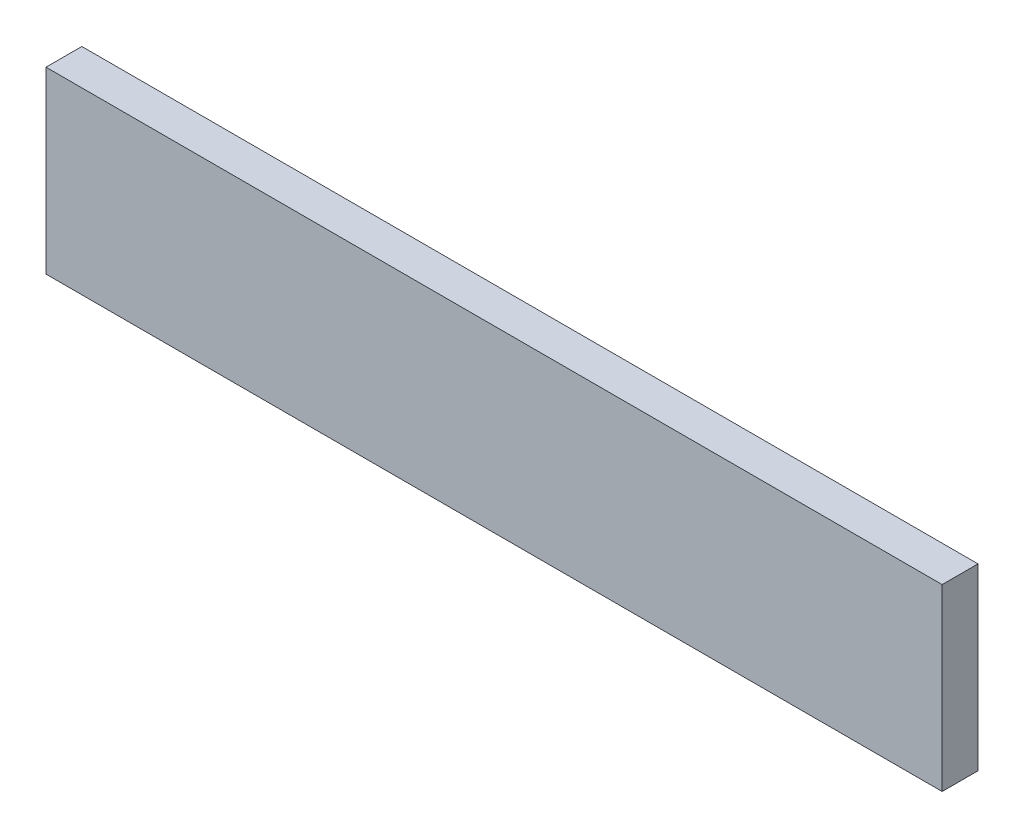
from build123d import *

# Parameters (mm, degrees)
SKETCH1_W           = 50
SKETCH1_H           = 10
BOSS_EXTRUDE1_DEPTH = 2


with BuildPart() as part:
    # Sketch1 → Boss-Extrude1 (new body)
    with BuildSketch(Plane.XY):
        Rectangle(SKETCH1_W, SKETCH1_H)
    extrude(amount=BOSS_EXTRUDE1_DEPTH)


solid = part.part
